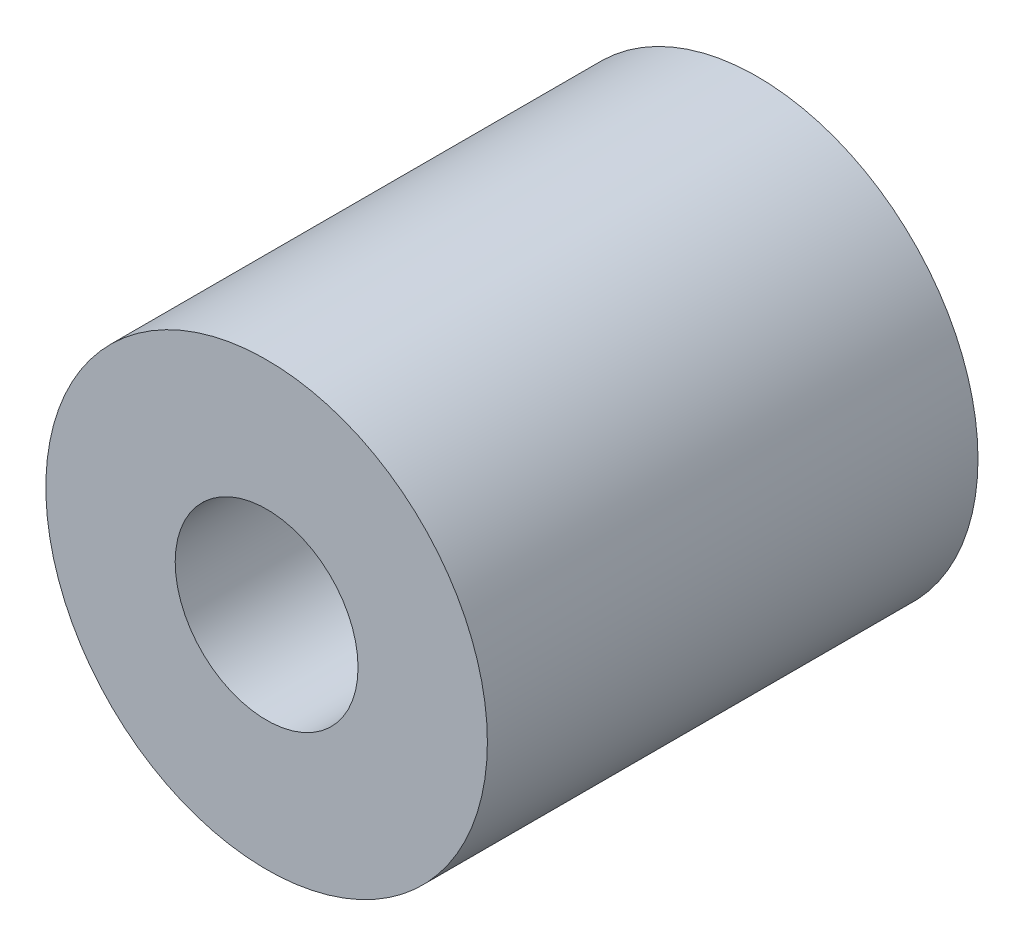
from build123d import *

# Parameters (mm, degrees)
ESQUISSE1_R        = 4.95
ESQUISSE1_R_2      = 2.05
BOSS_EXTRU_1_DEPTH = 11


with BuildPart() as part:
    # Esquisse1 → Boss.-Extru.1 (new body)
    with BuildSketch(Plane.XY):
        Circle(ESQUISSE1_R)
        Circle(ESQUISSE1_R_2, mode=Mode.SUBTRACT)
    extrude(amount=BOSS_EXTRU_1_DEPTH)


solid = part.part
